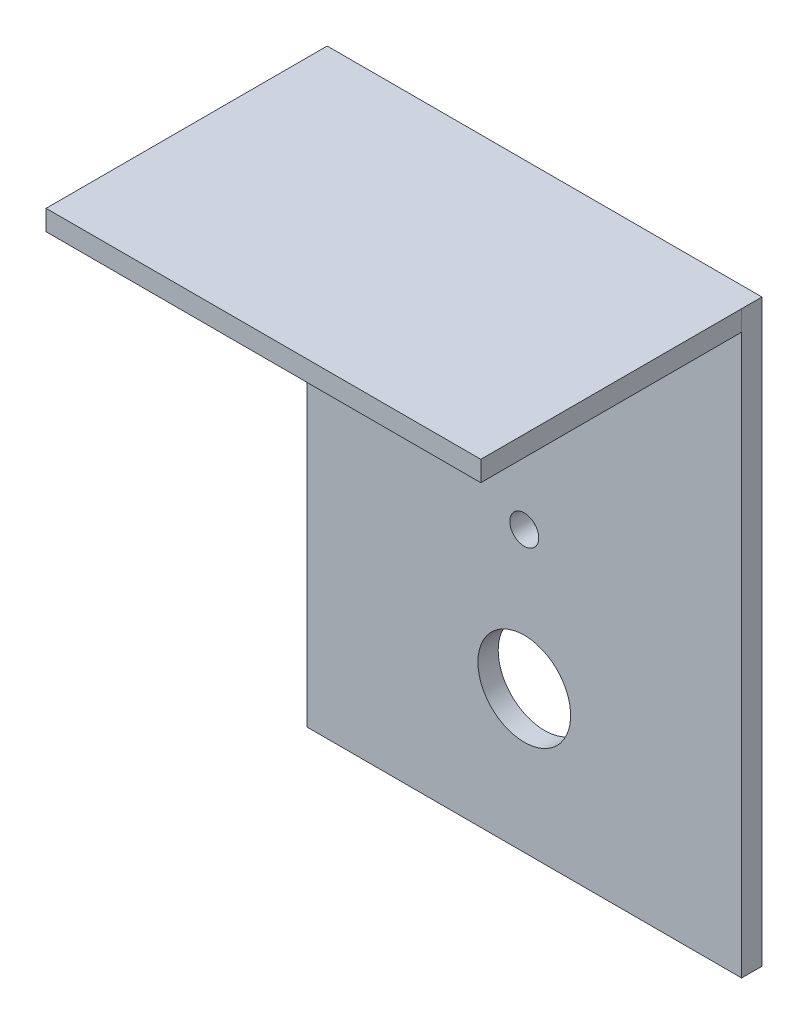
from build123d import *

# Parameters (mm, degrees)
SKETCH1_W           = 75
SKETCH1_H           = 45
BOSS_EXTRUDE1_DEPTH = 3.5
SKETCH2_W           = 74.999337444
SKETCH2_H           = 100
BOSS_EXTRUDE2_DEPTH = 3.5
SKETCH3_R           = 8
SKETCH3_R_2         = 2.5
CUT_EXTRUDE2_DEPTH  = 132.48954331


with BuildPart() as part:
    # Sketch1 → Boss-Extrude1 (new body)
    with BuildSketch(Plane(origin=(0, 0, 0), x_dir=(1, 0, 0), z_dir=(0, 1, 0))):
        with Locations((37.5, 22.5)):
            Rectangle(SKETCH1_W, SKETCH1_H)
    extrude(amount=BOSS_EXTRUDE1_DEPTH)

    # Sketch2 → Boss-Extrude2 (add)
    with BuildSketch(Plane(origin=(0, 0, -45), x_dir=(-1, 0, 0), z_dir=(0, 0, -1))):
        with Locations((-37.499668722, -46.5)):
            Rectangle(SKETCH2_W, SKETCH2_H)
    extrude(amount=BOSS_EXTRUDE2_DEPTH)

    # Sketch3 → Cut-Extrude2 (cut, through all)
    with BuildSketch(Plane(origin=(0, 0, -48.5), x_dir=(-1, 0, 0), z_dir=(0, 0, -1))):
        with Locations((-37.49990734, -24.47055223)):
            Circle(SKETCH3_R)
        with Locations((-37.49990734, -72.02944777)):
            Circle(SKETCH3_R)
        with Locations((-37.499668722, -48.25)):
            Circle(SKETCH3_R_2)
    extrude(amount=-CUT_EXTRUDE2_DEPTH, mode=Mode.SUBTRACT)


solid = part.part
